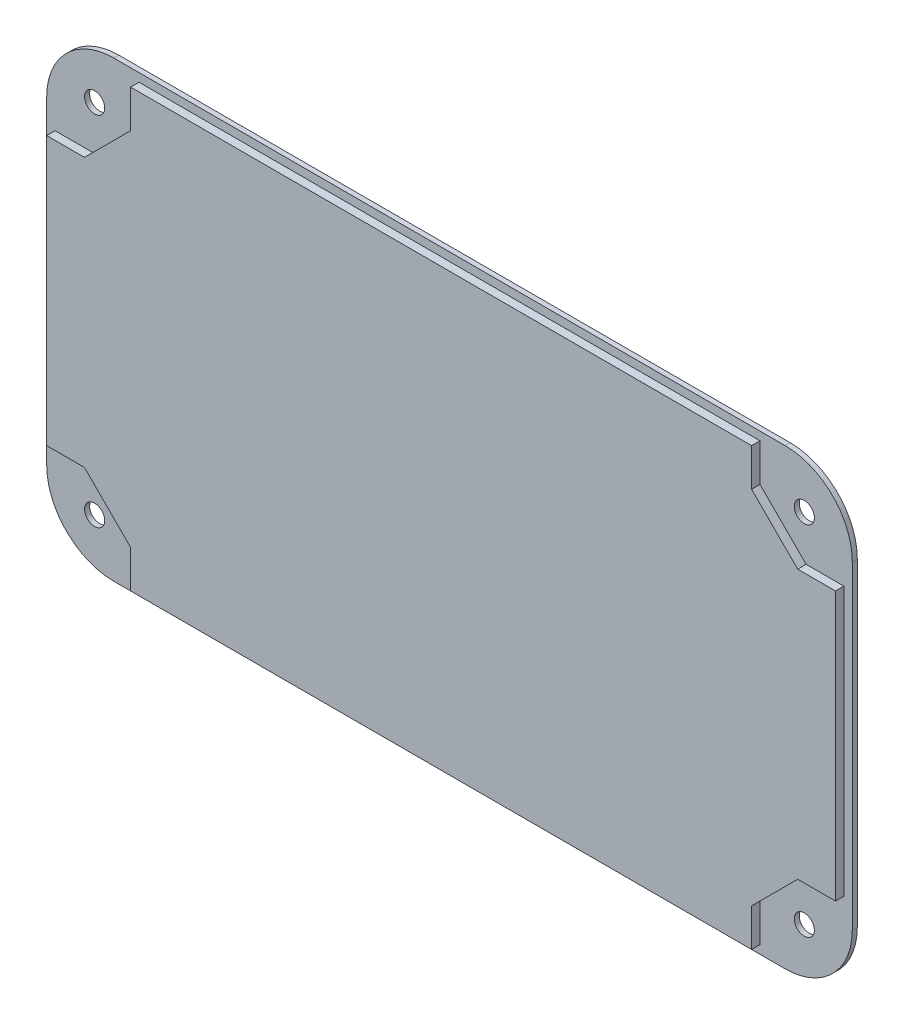
from build123d import *

# Parameters (mm, degrees)
BOSS_EXTRUDE1_DEPTH     = 1.5
CUT_EXTRUDE1_DEPTH      = 138.689868908
CUT_EXTRUDE1_DEPTH_BACK = 138.689868908
SKETCH2_R               = 3
BOSS_EXTRUDE2_DEPTH     = 2.5


with BuildPart() as part:
    # Sketch1 → Boss-Extrude1 (new body)
    with BuildSketch(Plane.XY):
        with BuildLine():
            Line((-100, -67.5), (100, -67.5))
            ThreePointArc((100, -67.5), (114.142135624, -61.642135624), (120, -47.5))
            Line((120, -47.5), (120, 47.5))
            ThreePointArc((120, 47.5), (114.142135624, 61.642135624), (100, 67.5))
            Line((100, 67.5), (-100, 67.5))
            ThreePointArc((-100, 67.5), (-114.142135624, 61.642135624), (-120, 47.5))
            Line((-120, 47.5), (-120, -47.5))
            ThreePointArc((-120, -47.5), (-114.142135624, -61.642135624), (-100, -67.5))
        make_face()
    extrude(amount=BOSS_EXTRUDE1_DEPTH)

    # Sketch2 → Cut-Extrude1 (cut, two sides: drawn at the far end of the back side and taken through both)
    with BuildSketch(Plane.XY.offset(1.5).offset(-CUT_EXTRUDE1_DEPTH_BACK)):
        with Locations((105.710599836, 53.210599836)):
            Circle(SKETCH2_R)
        with Locations((105.710599836, -53.210599836)):
            Circle(SKETCH2_R)
        with Locations((-105.710599836, -53.210599836)):
            Circle(SKETCH2_R)
        with Locations((-105.710599836, 53.210599836)):
            Circle(SKETCH2_R)
    extrude(amount=CUT_EXTRUDE1_DEPTH + CUT_EXTRUDE1_DEPTH_BACK, mode=Mode.SUBTRACT)

    # Sketch2<3> → Boss-Extrude2 (add)
    with BuildSketch(Plane.XY.offset(1.5)):
        Polygon((-92.5, -53.75), (-92.5, -65), (92.5, -65), (92.5, -53.75), (106.25, -40), (117.5, -40), (117.5, 40), (106.25, 40), (92.5, 53.75), (92.5, 65), (-92.5, 65), (-92.5, 53.75), (-106.25, 40), (-117.5, 40), (-117.5, -40), (-106.25, -40), align=None)
    extrude(amount=BOSS_EXTRUDE2_DEPTH)


solid = part.part
